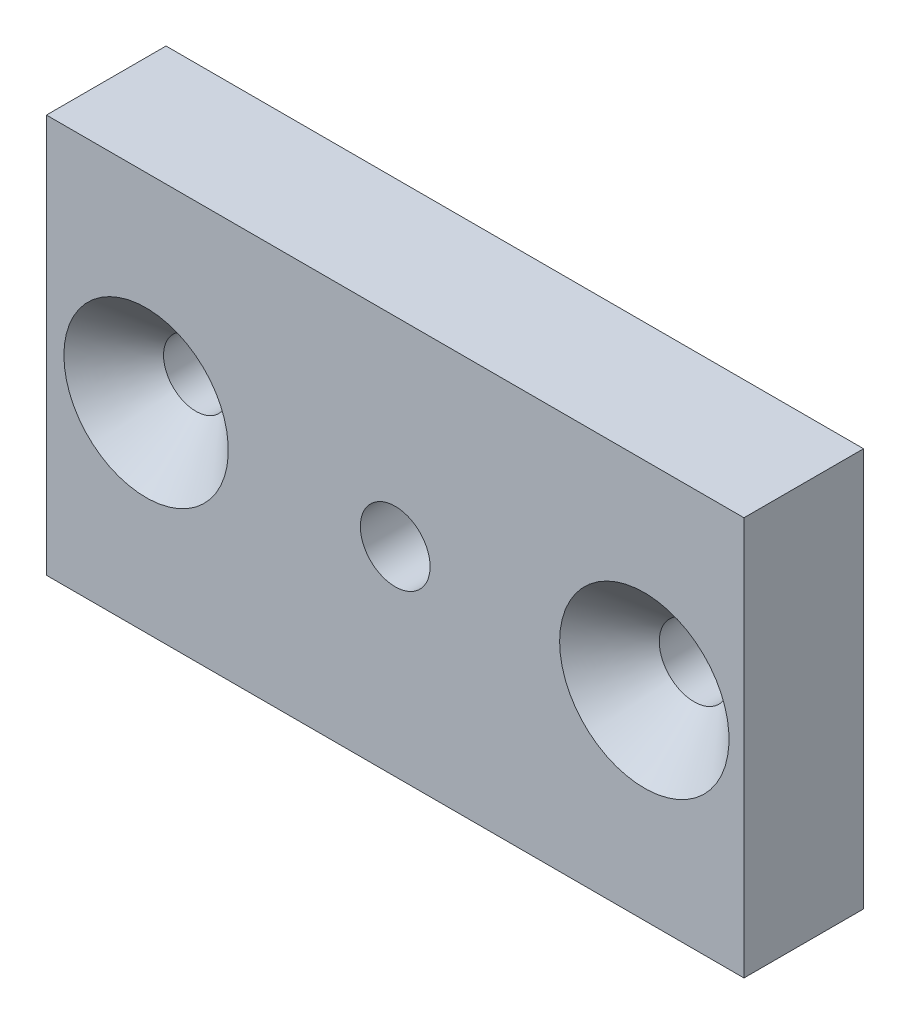
from build123d import *

# Parameters (mm, degrees)
SKETCH1_W           = 35
SKETCH1_H           = 20
SKETCH1_R           = 1.625
SKETCH1_R_2         = 1.75
BOSS_EXTRUDE1_DEPTH = 6
CHAMFER1_SIZE       = 2.5
CUT_EXTRUDE1_DEPTH  = 2.5


with BuildPart() as part:
    # Sketch1 → Boss-Extrude1 (new body)
    with BuildSketch(Plane.XY):
        with Locations((17.5, 10)):
            Rectangle(SKETCH1_W, SKETCH1_H)
        with Locations((5, 10)):
            Circle(SKETCH1_R, mode=Mode.SUBTRACT)
        with Locations((30, 10)):
            Circle(SKETCH1_R_2, mode=Mode.SUBTRACT)
        with Locations((17.5, 10)):
            Circle(SKETCH1_R_2, mode=Mode.SUBTRACT)
    extrude(amount=BOSS_EXTRUDE1_DEPTH)

    # Chamfer1
    chamfer1_edges = [part.edges().sort_by_distance(p)[0] for p in [
        (3.375, 10, 6),
        (28.25, 10, 6),
    ]]
    chamfer(chamfer1_edges, length=CHAMFER1_SIZE)

    # Sketch2 → Cut-Extrude1 (cut)
    with BuildSketch(Plane(origin=(0, 0, 0), x_dir=(-1, 0, 0), z_dir=(0, 0, -1))):
        Polygon((-19.376388375, 13.25), (-21.25277675, 10), (-19.376388375, 6.75), (-15.623611625, 6.75), (-13.74722325, 10), (-15.623611625, 13.25), align=None)
    extrude(amount=-CUT_EXTRUDE1_DEPTH, mode=Mode.SUBTRACT)


solid = part.part
